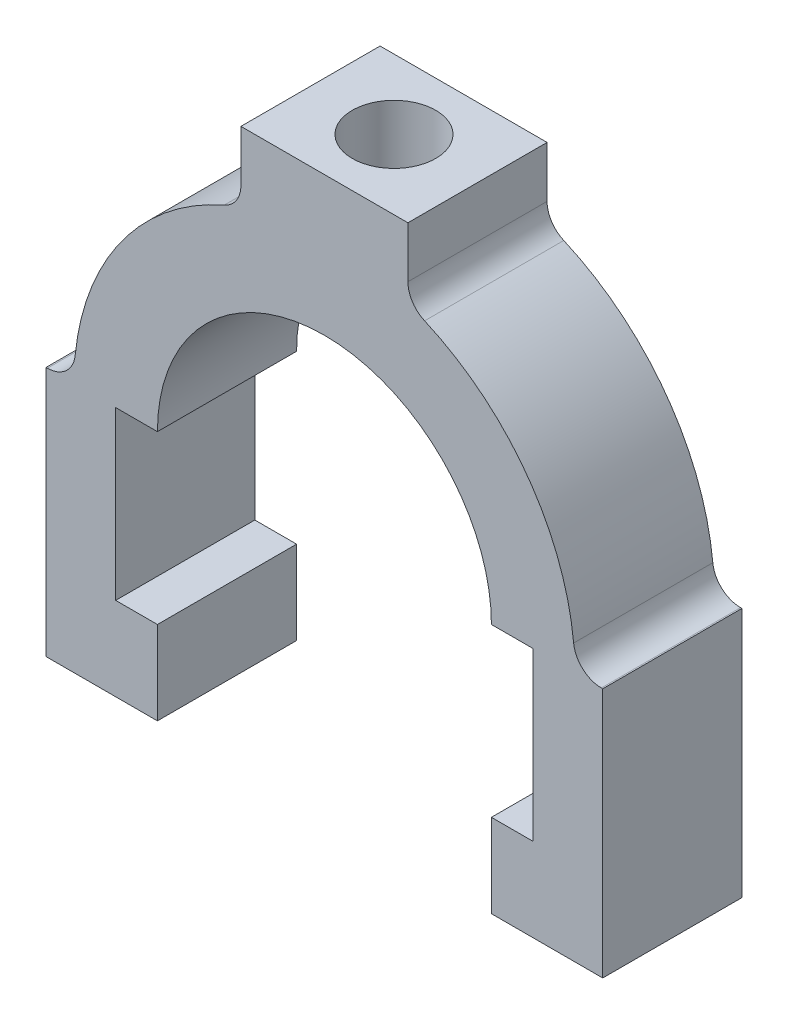
from build123d import *

# Parameters (mm, degrees)
BOSS_EXTRUDE1_DEPTH = 20
SKETCH2_R           = 6
CUT_EXTRUDE1_DEPTH  = 25


with BuildPart() as part:
    # Sketch1 → Boss-Extrude1 (new body)
    with BuildSketch(Plane.XY):
        with BuildLine():
            Line((24, 0), (30, 0))
            Line((30, 0), (30, -24))
            Line((30, -24), (24, -24))
            Line((24, -24), (24, -36))
            Line((24, -36), (40, -36))
            Line((40, -36), (40, 0))
            Line((40, 0), (39.799497484, 0))
            ThreePointArc((39.799497484, 0), (37.116215911, 1.033520605), (35.819547736, 3.6))
            ThreePointArc((35.819547736, 3.6), (29.094854574, 21.201165942), (14.4, 32.994545004))
            ThreePointArc((14.4, 32.994545004), (12.653359894, 34.46971533), (12, 36.66060556))
            Line((12, 36.66060556), (12, 44))
            Line((12, 44), (-12, 44))
            Line((-12, 44), (-12, 36.66060556))
            ThreePointArc((-12, 36.66060556), (-12.653359894, 34.46971533), (-14.4, 32.994545004))
            ThreePointArc((-14.4, 32.994545004), (-29.094854574, 21.201165942), (-35.819547736, 3.6))
            ThreePointArc((-35.819547736, 3.6), (-37.116215911, 1.033520605), (-39.799497484, 0))
            Line((-39.799497484, 0), (-40, 0))
            Line((-40, 0), (-40, -36))
            Line((-40, -36), (-24, -36))
            Line((-24, -36), (-24, -24))
            Line((-24, -24), (-30, -24))
            Line((-30, -24), (-30, 0))
            Line((-30, 0), (-24, 0))
            ThreePointArc((-24, 0), (0, 24), (24, 0))
        make_face()
    extrude(amount=BOSS_EXTRUDE1_DEPTH)

    # Sketch2 → Cut-Extrude1 (cut)
    with BuildSketch(Plane(origin=(0, 44, 0), x_dir=(1, 0, 0), z_dir=(0, 1, 0))):
        with Locations(Location((0, -10, 0), (0, 0, 270))):
            Circle(SKETCH2_R)
    extrude(amount=-CUT_EXTRUDE1_DEPTH, mode=Mode.SUBTRACT)


solid = part.part
